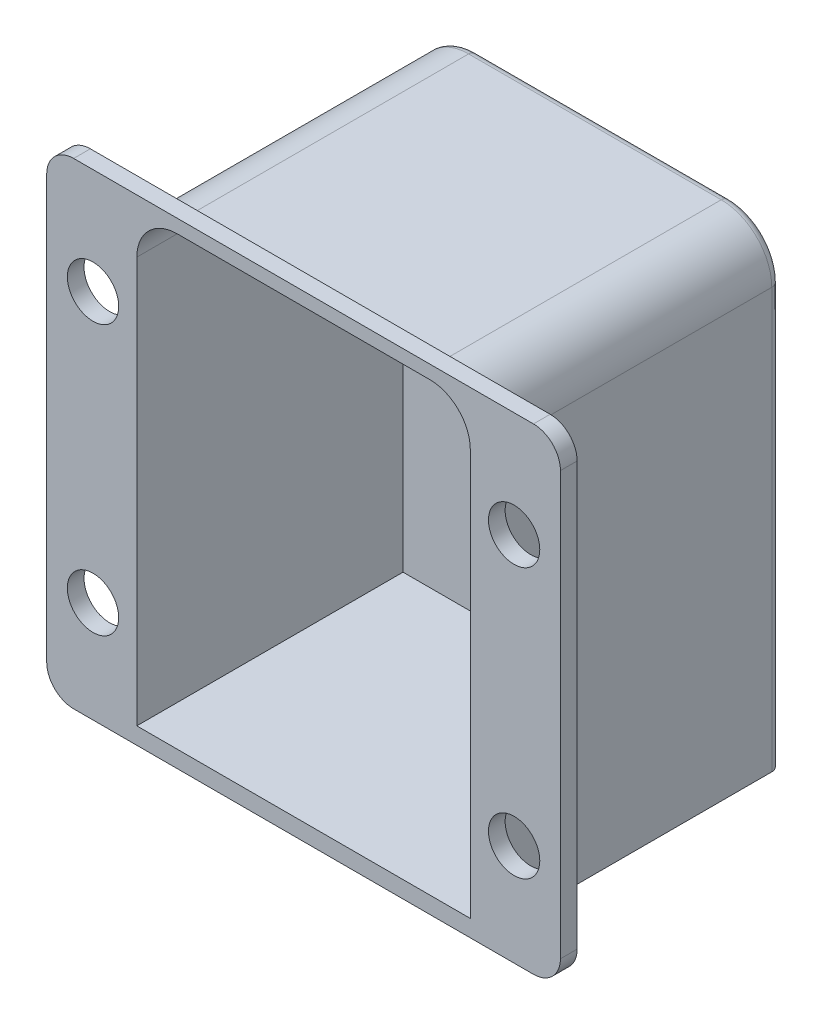
from build123d import *

# Parameters (mm, degrees)
BASE_EXTRUDE_DEPTH  = 0.9906
SKETCH8_R           = 1.524
CUT_EXTRUDE4_DEPTH  = 27.808529889
BOSS_EXTRUDE5_DEPTH = 16.8148
FILLET3_R           = 0.508
CUT_EXTRUDE5_DEPTH  = 15.8054
LPATTERN1_COUNT     = 2
LPATTERN1_PITCH     = 16


with BuildPart() as part:
    # Sketch1 → Base-Extrude (new body)
    with BuildSketch(Plane.XY):
        with BuildLine():
            Line((-13.6498, 6.2738), (13.6498, 6.2738))
            ThreePointArc((13.6498, 6.2738), (14.781312271, 5.805112271), (15.25, 4.6736))
            Line((15.25, 4.6736), (15.25, -20.426))
            ThreePointArc((15.25, -20.426), (14.781312271, -21.557512271), (13.6498, -22.0262))
            Line((13.6498, -22.0262), (-13.6498, -22.0262))
            ThreePointArc((-13.6498, -22.0262), (-14.781312271, -21.557512271), (-15.25, -20.426))
            Line((-15.25, -20.426), (-15.25, 4.6736))
            ThreePointArc((-15.25, 4.6736), (-14.781312271, 5.805112271), (-13.6498, 6.2738))
        make_face()
    extrude(amount=-BASE_EXTRUDE_DEPTH)

    # Sketch8 → Cut-Extrude4 (cut, through all)
    with BuildSketch(Plane.XY):
        with Locations((12.5, 0)):
            Circle(SKETCH8_R)
        with Locations(Location((-12.5, 0, 0), (0, 0, 180))):
            Circle(SKETCH8_R)
    cut_extrude4 = extrude(amount=-CUT_EXTRUDE4_DEPTH, mode=Mode.SUBTRACT)

    # Sketch14 → Boss-Extrude5 (add)
    with BuildSketch(Plane(origin=(0, 0, -0.9906), x_dir=(-1, 0, 0), z_dir=(0, 0, -1))):
        with BuildLine():
            Line((-10.5, 3.0738), (-10.5, -21.841863832))
            Line((-10.5, -21.841863832), (10.5, -21.841863832))
            Line((10.5, -21.841863832), (10.5, 3.0738))
            ThreePointArc((10.5, 3.0738), (9.621320344, 5.195120344), (7.5, 6.0738))
            Line((7.5, 6.0738), (-7.5, 6.0738))
            ThreePointArc((-7.5, 6.0738), (-9.621320344, 5.195120344), (-10.5, 3.0738))
        make_face()
    extrude(amount=BOSS_EXTRUDE5_DEPTH)

    # Fillet3
    fillet3_edges = [part.edges().sort_by_distance(p)[0] for p in [
        (-9.621320344, 5.195120344, -17.8054),
        (9.621320344, 5.195120344, -17.8054),
        (-10.5, -9.384031916, -17.8054),
        (0, 6.0738, -17.8054),
        (10.5, -9.384031916, -17.8054),
    ]]
    fillet(fillet3_edges, radius=FILLET3_R)

    # Sketch15 → Cut-Extrude5 (cut)
    with BuildSketch(Plane.XY):
        with BuildLine():
            Line((9.9, -21.0262), (-9.9, -21.0262))
            Line((-9.9, -21.0262), (-9.9, 3.0738))
            ThreePointArc((-9.9, 3.0738), (-9.197056275, 4.770856275), (-7.5, 5.4738))
            Line((-7.5, 5.4738), (7.5, 5.4738))
            ThreePointArc((7.5, 5.4738), (9.197056275, 4.770856275), (9.9, 3.0738))
            Line((9.9, 3.0738), (9.9, -21.0262))
        make_face()
    extrude(amount=-CUT_EXTRUDE5_DEPTH, mode=Mode.SUBTRACT)

    # LPattern1: Cut-Extrude4 ×2
    with Locations(*[(0, -i * LPATTERN1_PITCH, 0) for i in range(1, LPATTERN1_COUNT)]):
        add(cut_extrude4, mode=Mode.SUBTRACT)


solid = part.part
